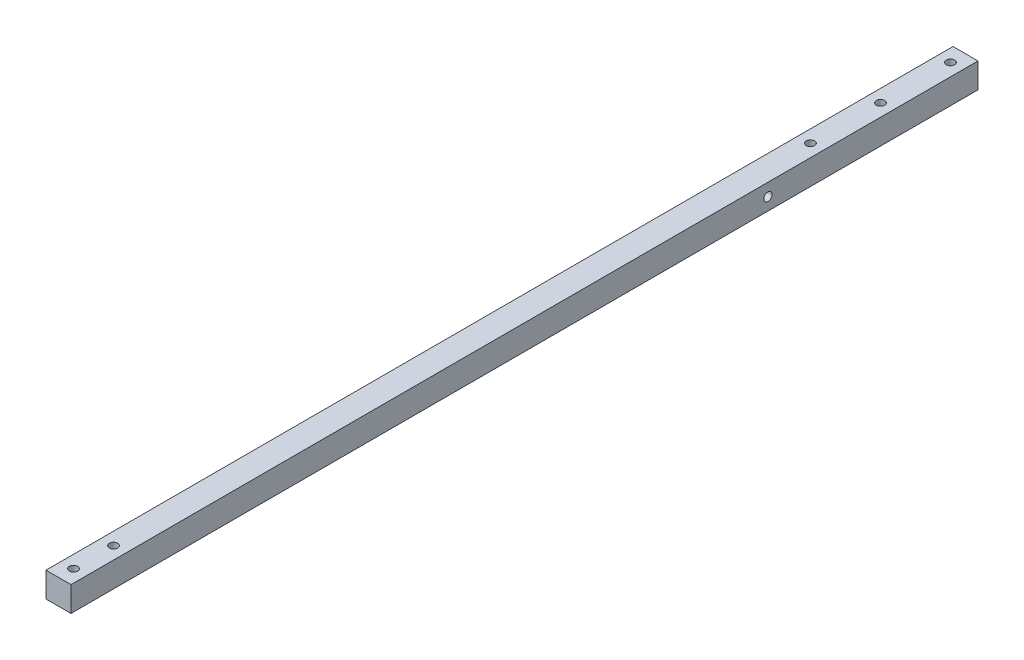
from build123d import *

# Parameters (mm, degrees)
ESQUISSE1_W             = 7.5
ESQUISSE1_H             = 7.5
BOSS_EXTRU_1_DEPTH      = 272
ESQUISSE2_R             = 1.25
ENL_V_MAT_EXTRU_1_DEPTH = 273.129220225
ESQUISSE3_R             = 1.25
ENL_V_MAT_EXTRU_2_DEPTH = 273.129220225


with BuildPart() as part:
    # Esquisse1 → Boss.-Extru.1 (new body)
    with BuildSketch(Plane.XY):
        Rectangle(ESQUISSE1_W, ESQUISSE1_H)
    extrude(amount=BOSS_EXTRU_1_DEPTH)

    # Esquisse2 → Enlèv. mat.-Extru.1 (cut, through all)
    with BuildSketch(Plane(origin=(0, 3.75, 0), x_dir=(1, 0, 0), z_dir=(0, 1, 0))):
        with Locations(Location((0, -4.5, 0), (0, 0, 270))):
            Circle(ESQUISSE2_R)
        with Locations(Location((0, -25.5, 0), (0, 0, 270))):
            Circle(ESQUISSE2_R)
        with Locations(Location((0, -46.5, 0), (0, 0, 270))):
            Circle(ESQUISSE2_R)
        with Locations(Location((0, -255.5, 0), (0, 0, 270))):
            Circle(ESQUISSE2_R)
        with Locations(Location((0, -267.5, 0), (0, 0, 270))):
            Circle(ESQUISSE2_R)
    extrude(amount=-ENL_V_MAT_EXTRU_1_DEPTH, mode=Mode.SUBTRACT)

    # Esquisse3 → Enlèv. mat.-Extru.2 (cut, through all)
    with BuildSketch(Plane(origin=(3.75, 0, 0), x_dir=(0, 0, -1), z_dir=(1, 0, 0))):
        with Locations((-63, 0)):
            Circle(ESQUISSE3_R)
    extrude(amount=-ENL_V_MAT_EXTRU_2_DEPTH, mode=Mode.SUBTRACT)


solid = part.part
